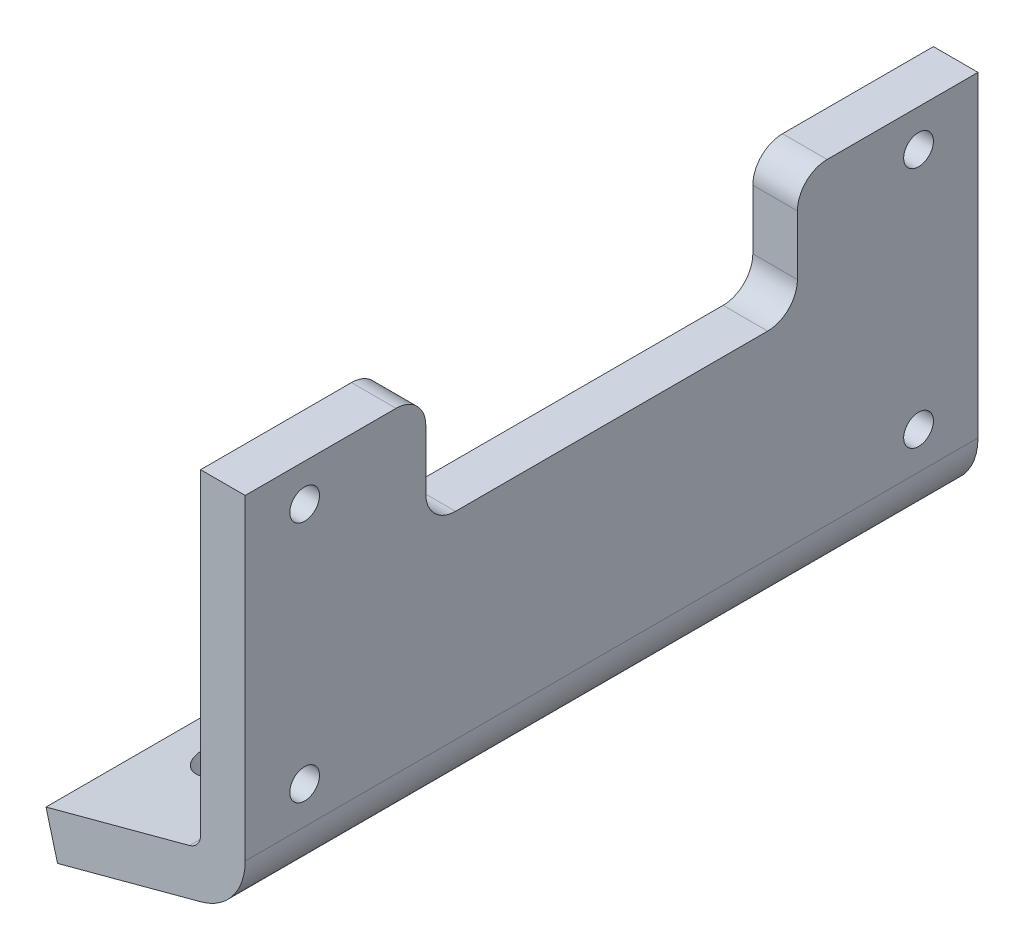
from build123d import *

# Parameters (mm, degrees)
BOSS_EXTRUDE2_DEPTH = 49.3
SKETCH3_R           = 1
CUT_EXTRUDE1_DEPTH  = 55.974100913
SKETCH4_R           = 2.25
CUT_EXTRUDE2_DEPTH  = 56.188642368
SKETCH5_W           = 25
SKETCH5_H           = 8
CUT_EXTRUDE3_DEPTH  = 55.974100913
FILLET1_R           = 2


with BuildPart() as part:
    # Sketch2 → Boss-Extrude2 (new body)
    with BuildSketch(Plane.XY):
        with BuildLine():
            Line((-2.241180955, -1.965925826), (-11.900439218, -4.554116277))
            Line((-11.900439218, -4.554116277), (-11.123982082, -7.451893756))
            Line((-11.123982082, -7.451893756), (-1.46472382, -4.863703305))
            ThreePointArc((-1.46472382, -4.863703305), (0.673413361, -3.435045716), (1.5, -1))
            Line((1.5, -1), (1.5, 20.3))
            Line((1.5, 20.3), (-1.5, 20.3))
            Line((-1.5, 20.3), (-1.5, -1))
            ThreePointArc((-1.5, -1), (-1.70664666, -1.608761429), (-2.241180955, -1.965925826))
        make_face()
    extrude(amount=BOSS_EXTRUDE2_DEPTH)

    # Sketch3 → Cut-Extrude1 (cut, through all)
    with BuildSketch(Plane(origin=(1.5, 0, 0), x_dir=(0, 0, -1), z_dir=(1, 0, 0))):
        with Locations(Location((-45.3, 17.8, 0), (0, 0, 90))):
            Circle(SKETCH3_R)
        with Locations(Location((-4, 17.8, 0), (0, 0, 90))):
            Circle(SKETCH3_R)
        with Locations(Location((-4, 1.5, 0), (0, 0, 90))):
            Circle(SKETCH3_R)
        with Locations(Location((-45.3, 1.5, 0), (0, 0, 90))):
            Circle(SKETCH3_R)
    extrude(amount=-CUT_EXTRUDE1_DEPTH, mode=Mode.SUBTRACT)

    # Sketch4 → Cut-Extrude2 (cut, through all)
    with BuildSketch(Plane(origin=(0.3413508, -1.273938528, 0), x_dir=(0.96592582628907, 0.25881904510251463, 0), z_dir=(-0.25881904510251463, 0.96592582628907, 0))):
        with Locations(Location((-7.673633611, -8, 0), (0, 0, 180))):
            Circle(SKETCH4_R)
        with Locations(Location((-7.673633611, -41.3, 0), (0, 0, 180))):
            Circle(SKETCH4_R)
    extrude(amount=-CUT_EXTRUDE2_DEPTH, mode=Mode.SUBTRACT)

    # Sketch5 → Cut-Extrude3 (cut, through all)
    with BuildSketch(Plane(origin=(1.5, 0, 0), x_dir=(0, 0, -1), z_dir=(1, 0, 0))):
        with Locations((-24.65, 16.3)):
            Rectangle(SKETCH5_W, SKETCH5_H)
    extrude(amount=-CUT_EXTRUDE3_DEPTH, mode=Mode.SUBTRACT)

    # Fillet1
    fillet1_edges = [part.edges().sort_by_distance(p)[0] for p in [
        (0, 20.3, 12.15),
        (0, 20.3, 37.15),
        (0, 12.3, 12.15),
        (0, 12.3, 37.15),
    ]]
    fillet(fillet1_edges, radius=FILLET1_R)


solid = part.part
